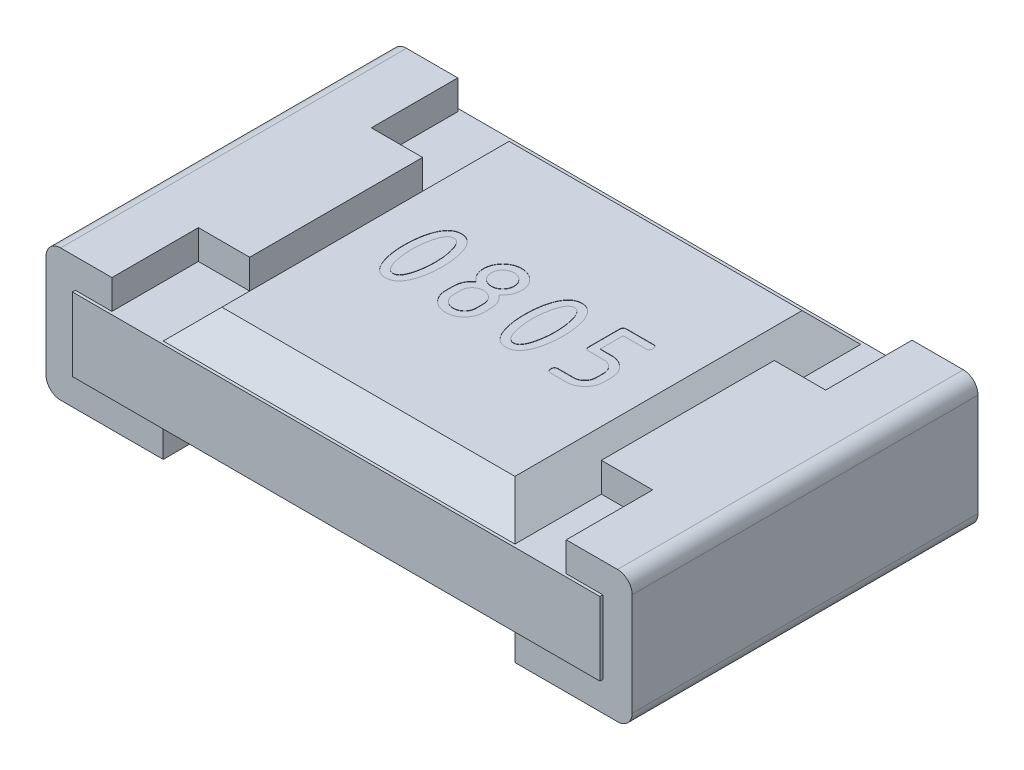
from build123d import *

# Parameters (mm, degrees)
SKETCH1_W           = 1.8
SKETCH1_H           = 1.2
BOSS_EXTRUDE1_DEPTH = 0.125
SKETCH2_W           = 0.4
SKETCH2_H           = 1.18
BOSS_EXTRUDE2_DEPTH = 0.225
FILLET1_R           = 0.05
SKETCH6_W           = 1.55
SKETCH6_H           = 0.295
CUT_EXTRUDE2_DEPTH  = 0.1
SKETCH4_W           = 1.2
SKETCH4_H           = 1.18
BOSS_EXTRUDE3_DEPTH = 0.1
BOSS_EXTRUDE3_TAPER = 45
CUT_EXTRUDE1_DEPTH  = 0.001


with BuildPart() as part:
    # Sketch1 → Boss-Extrude1 (new, symmetric)
    with BuildSketch(Plane(origin=(0, 0, 0), x_dir=(1, 0, 0), z_dir=(0, 1, 0))):
        Rectangle(SKETCH1_W, SKETCH1_H)
    extrude(amount=BOSS_EXTRUDE1_DEPTH, both=True)

    # Sketch2 → Boss-Extrude2 (add, symmetric)
    with BuildSketch(Plane(origin=(0, 0, 0), x_dir=(1, 0, 0), z_dir=(0, 1, 0))):
        with Locations((-0.8, 0)):
            Rectangle(SKETCH2_W, SKETCH2_H)
        with Locations((0.8, 0)):
            Rectangle(SKETCH2_W, SKETCH2_H)
    extrude(amount=BOSS_EXTRUDE2_DEPTH, both=True)

    # Fillet1
    fillet1_edges = [part.edges().sort_by_distance(p)[0] for p in [
        (-1, -0.225, 0),
        (-1, 0.225, 0),
        (1, -0.225, 0),
        (1, 0.225, 0),
    ]]
    fillet(fillet1_edges, radius=FILLET1_R)

    # Sketch6 → Cut-Extrude2 (cut)
    with BuildSketch(Plane(origin=(0, 0.225, 0), x_dir=(1, 0, 0), z_dir=(0, 1, 0))):
        with Locations((0, 0.4425)):
            Rectangle(SKETCH6_W, SKETCH6_H)
        with Locations((0, -0.4425)):
            Rectangle(SKETCH6_W, SKETCH6_H)
    extrude(amount=-CUT_EXTRUDE2_DEPTH, mode=Mode.SUBTRACT)

    # Sketch4 → Boss-Extrude3 (add)
    with BuildSketch(Plane(origin=(0, 0.125, 0), x_dir=(1, 0, 0), z_dir=(0, 1, 0))):
        Rectangle(SKETCH4_W, SKETCH4_H)
    extrude(amount=BOSS_EXTRUDE3_DEPTH, taper=BOSS_EXTRUDE3_TAPER)

    # Sketch5 → Cut-Extrude1 (cut)
    # profile 1 of 4: a face of its own
    with BuildSketch(Plane(origin=(0, 0.225, 0), x_dir=(1, 0, 0), z_dir=(0, 1, 0))):
        with BuildLine():
            add(Edge.make_bspline(
                [(-0.2431, 0.006067785), (-0.243134366, 0.002256348), (-0.24320191, -0.00523479), (-0.243705927, -0.016272331), (-0.244676967, -0.026911155), (-0.245834586, -0.037164348), (-0.247489186, -0.047014055), (-0.249461091, -0.056481238), (-0.251734885, -0.065579409), (-0.253612278, -0.071438245), (-0.254533036, -0.074311679)],
                knots=[0, 0, 0, 0, 1.121884543, 2.204992808, 3.251003932, 4.265943523, 5.241379217, 6.189508073, 7.112053941, 8, 8, 8, 8], degree=3))
            add(Edge.make_bspline(
                [(-0.254533036, -0.074311679), (-0.25593627, -0.078216876), (-0.258619185, -0.085683417), (-0.263819077, -0.095811545), (-0.269537136, -0.104482554), (-0.275985187, -0.111572283), (-0.283068184, -0.117140302), (-0.290837197, -0.121126628), (-0.299271828, -0.123531475), (-0.305124578, -0.123797151), (-0.3081, -0.123932215)],
                knots=[0, 0, 0, 0, 1.267950427, 2.424258098, 3.472816797, 4.435939713, 5.342465326, 6.213003319, 7.091526505, 8, 8, 8, 8], degree=3))
            add(Edge.make_bspline(
                [(-0.3081, -0.123932215), (-0.311075194, -0.123796863), (-0.316927496, -0.123530621), (-0.325365393, -0.121129902), (-0.333111459, -0.117133378), (-0.340235869, -0.111637437), (-0.346641916, -0.104543318), (-0.352384312, -0.095933255), (-0.357592635, -0.08584357), (-0.360265791, -0.07839176), (-0.361666964, -0.074485787)],
                knots=[0, 0, 0, 0, 0.910041478, 1.790080955, 2.662121456, 3.566587881, 4.531373102, 5.576831042, 6.729861149, 8, 8, 8, 8], degree=3))
            add(Edge.make_bspline(
                [(-0.361666964, -0.074485787), (-0.362587784, -0.071612362), (-0.364465304, -0.065753547), (-0.366738106, -0.056655216), (-0.368717853, -0.047169982), (-0.370358986, -0.03729872), (-0.371527901, -0.027008391), (-0.372490729, -0.016349391), (-0.372999665, -0.005273558), (-0.373066109, 0.002236977), (-0.3731, 0.006067785)],
                knots=[0, 0, 0, 0, 0.886064917, 1.806656342, 2.752776557, 3.731751904, 4.744541313, 5.793997073, 6.874810739, 8, 8, 8, 8], degree=3))
            add(Edge.make_bspline(
                [(-0.3731, 0.006067785), (-0.373066109, 0.009898593), (-0.372999665, 0.017409127), (-0.372490729, 0.028484961), (-0.371527901, 0.039143961), (-0.370358986, 0.04943429), (-0.368717853, 0.059305552), (-0.366738106, 0.068790786), (-0.364465304, 0.077889117), (-0.362587784, 0.083747932), (-0.361666964, 0.086621356)],
                knots=[0, 0, 0, 0, 1.125189261, 2.206002927, 3.255458687, 4.268248096, 5.247223443, 6.193343658, 7.113935083, 8, 8, 8, 8], degree=3))
            add(Edge.make_bspline(
                [(-0.361666964, 0.086621356), (-0.360265791, 0.09052733), (-0.357592635, 0.09797914), (-0.352384312, 0.108068825), (-0.346641916, 0.116678887), (-0.340235869, 0.123773007), (-0.333111459, 0.129268948), (-0.325365393, 0.133265472), (-0.316927496, 0.135666191), (-0.311075194, 0.135932433), (-0.3081, 0.136067785)],
                knots=[0, 0, 0, 0, 1.270138851, 2.423168958, 3.468626898, 4.433412119, 5.337878544, 6.209919045, 7.089958522, 8, 8, 8, 8], degree=3))
            add(Edge.make_bspline(
                [(-0.3081, 0.136067785), (-0.305124578, 0.135932721), (-0.299271828, 0.135667045), (-0.290837197, 0.133262198), (-0.283068184, 0.129275872), (-0.275985187, 0.123707853), (-0.269537136, 0.116618124), (-0.263819077, 0.107947115), (-0.258619185, 0.097818987), (-0.25593627, 0.090352446), (-0.254533036, 0.086447249)],
                knots=[0, 0, 0, 0, 0.908473495, 1.786996681, 2.657534674, 3.564060287, 4.527183203, 5.575741902, 6.732049573, 8, 8, 8, 8], degree=3))
            add(Edge.make_bspline(
                [(-0.254533036, 0.086447249), (-0.253612278, 0.083573815), (-0.251734885, 0.077714979), (-0.249461091, 0.068616808), (-0.247489186, 0.059149625), (-0.245834586, 0.049299917), (-0.244676967, 0.039046725), (-0.243705927, 0.0284079), (-0.24320191, 0.01737036), (-0.243134366, 0.009879222), (-0.2431, 0.006067785)],
                knots=[0, 0, 0, 0, 0.887946059, 1.810491927, 2.758620783, 3.734056477, 4.748996068, 5.795007192, 6.878115457, 8, 8, 8, 8], degree=3))
        make_face()
        with BuildLine():
            add(Edge.make_bspline(
                [(-0.2691, 0.006067785), (-0.269164565, 0.011371774), (-0.269292258, 0.021861697), (-0.270712498, 0.037336367), (-0.272766495, 0.052375139), (-0.274933736, 0.062123185), (-0.27600625, 0.066947249)],
                knots=[0, 0, 0, 0, 1.036187695, 2.04931225, 3.03465332, 4, 4, 4, 4], degree=3))
            add(Edge.make_bspline(
                [(-0.27600625, 0.066947249), (-0.276882506, 0.070328868), (-0.278537274, 0.076714897), (-0.281670154, 0.085514047), (-0.285090165, 0.093008527), (-0.288945851, 0.099144454), (-0.293100358, 0.104052317), (-0.297760839, 0.107515979), (-0.302822314, 0.10964842), (-0.306339631, 0.109927906), (-0.3081, 0.110067785)],
                knots=[0, 0, 0, 0, 1.452784662, 2.743516012, 3.881318599, 4.872714509, 5.751019032, 6.539832634, 7.269206463, 8, 8, 8, 8], degree=3))
            add(Edge.make_bspline(
                [(-0.3081, 0.110067785), (-0.309863297, 0.109935467), (-0.313375934, 0.10967188), (-0.318369442, 0.10743954), (-0.322988428, 0.103996272), (-0.327093214, 0.099056903), (-0.330919978, 0.092903131), (-0.334370439, 0.085384287), (-0.337484889, 0.076538566), (-0.339142239, 0.070115494), (-0.340019643, 0.066715106)],
                knots=[0, 0, 0, 0, 0.73024413, 1.454707756, 2.2364598, 3.108818404, 4.106268943, 5.243216136, 6.540552912, 8, 8, 8, 8], degree=3))
            add(Edge.make_bspline(
                [(-0.340019643, 0.066715106), (-0.341107553, 0.061813218), (-0.343288879, 0.05198464), (-0.345441484, 0.036934862), (-0.346827562, 0.021608884), (-0.347008722, 0.011274716), (-0.3471, 0.006067785)],
                knots=[0, 0, 0, 0, 0.984359877, 1.973700231, 2.979037069, 4, 4, 4, 4], degree=3))
            add(Edge.make_bspline(
                [(-0.3471, 0.006067785), (-0.347035475, 0.000783139), (-0.346907864, -0.009668162), (-0.34548544, -0.025104115), (-0.343421597, -0.040159639), (-0.341265077, -0.049948647), (-0.34019375, -0.054811679)],
                knots=[0, 0, 0, 0, 1.032445105, 2.041839016, 3.027215061, 4, 4, 4, 4], degree=3))
            add(Edge.make_bspline(
                [(-0.34019375, -0.054811679), (-0.339317494, -0.058193298), (-0.337662726, -0.064579327), (-0.334529846, -0.073378478), (-0.331109835, -0.080872957), (-0.327254149, -0.087008885), (-0.323099642, -0.091916747), (-0.318439161, -0.095380409), (-0.313377686, -0.09751285), (-0.309860369, -0.097792336), (-0.3081, -0.097932215)],
                knots=[0, 0, 0, 0, 1.452784662, 2.743516012, 3.881318599, 4.872714509, 5.751019032, 6.539832634, 7.269206463, 8, 8, 8, 8], degree=3))
            add(Edge.make_bspline(
                [(-0.3081, -0.097932215), (-0.306339631, -0.097792336), (-0.302822314, -0.09751285), (-0.297760839, -0.095380409), (-0.293100358, -0.091916747), (-0.288945851, -0.087008885), (-0.285090165, -0.080872957), (-0.281670154, -0.073378478), (-0.278537274, -0.064579327), (-0.276882506, -0.058193298), (-0.27600625, -0.054811679)],
                knots=[0, 0, 0, 0, 0.730793537, 1.460167366, 2.248980968, 3.127285491, 4.118681401, 5.256483988, 6.547215338, 8, 8, 8, 8], degree=3))
            add(Edge.make_bspline(
                [(-0.27600625, -0.054811679), (-0.274934923, -0.049948647), (-0.272778403, -0.040159639), (-0.27071456, -0.025104115), (-0.269292136, -0.009668162), (-0.269164525, 0.000783139), (-0.2691, 0.006067785)],
                knots=[0, 0, 0, 0, 0.972784939, 1.958160984, 2.967554895, 4, 4, 4, 4], degree=3))
        make_face(mode=Mode.SUBTRACT)
    # profile 2 of 4: a face of its own
    with BuildSketch(Plane(origin=(0, 0.225, 0), x_dir=(1, 0, 0), z_dir=(0, 1, 0))):
        with BuildLine():
            add(Edge.make_bspline(
                [(-0.1027, -0.123932215), (-0.104907872, -0.123876259), (-0.109263799, -0.123765864), (-0.115669213, -0.122897593), (-0.121821128, -0.121353904), (-0.127739828, -0.119281028), (-0.13340418, -0.116600617), (-0.138778994, -0.113291115), (-0.143976144, -0.109482893), (-0.14877754, -0.105009755), (-0.153250678, -0.100208359), (-0.157058899, -0.095011209), (-0.160368402, -0.089636395), (-0.163048813, -0.083972043), (-0.165121689, -0.078053343), (-0.166665378, -0.071901428), (-0.167533649, -0.065496014), (-0.167644044, -0.061140088), (-0.1677, -0.058932215)],
                knots=[0, 0, 0, 0, 1.035857351, 2.043650141, 3.025599911, 4.00750772, 4.982044535, 5.959747152, 6.965575591, 8, 9.034424409, 10.040252848, 11.017955465, 11.99249228, 12.974400089, 13.956349859, 14.964142649, 16, 16, 16, 16], degree=3))
            Line((-0.1677, -0.058932215), (-0.1677, -0.032932215))
            add(Edge.make_bspline(
                [(-0.1677, -0.032932215), (-0.167624924, -0.030296622), (-0.167477796, -0.02513153), (-0.166234817, -0.017588942), (-0.164170805, -0.010459056), (-0.161429705, -0.003665696), (-0.157677592, 0.002630112), (-0.153262967, 0.008615198), (-0.147949142, 0.014142786), (-0.14392259, 0.017407091), (-0.141874107, 0.019067785)],
                knots=[0, 0, 0, 0, 1.048185513, 2.054176508, 3.031096563, 3.99737623, 4.959754699, 5.938825261, 6.951390663, 8, 8, 8, 8], degree=3))
            add(Edge.make_bspline(
                [(-0.141874107, 0.019067785), (-0.143922854, 0.020728333), (-0.147949927, 0.023992352), (-0.153259992, 0.029522005), (-0.15769825, 0.035513064), (-0.161397629, 0.041836796), (-0.164186674, 0.048606878), (-0.166231796, 0.05572588), (-0.167478597, 0.063266737), (-0.167625195, 0.068432069), (-0.1677, 0.071067785)],
                knots=[0, 0, 0, 0, 1.048668505, 2.061291041, 3.040416849, 4.009506313, 4.968732406, 5.945707584, 6.951755342, 8, 8, 8, 8], degree=3))
            add(Edge.make_bspline(
                [(-0.1677, 0.071067785), (-0.167643965, 0.073275616), (-0.167533413, 0.077631462), (-0.166666283, 0.084037468), (-0.165118391, 0.090187202), (-0.163066834, 0.096097458), (-0.160331876, 0.101732178), (-0.157098693, 0.107134698), (-0.15322603, 0.11228688), (-0.148784079, 0.117093737), (-0.143955941, 0.121553274), (-0.138798745, 0.125433659), (-0.133401581, 0.128732753), (-0.127740529, 0.131417524), (-0.12182094, 0.133489225), (-0.115669265, 0.135033231), (-0.109263786, 0.135901416), (-0.104907868, 0.136011823), (-0.1027, 0.136067785)],
                knots=[0, 0, 0, 0, 1.036004481, 2.043940414, 3.026029657, 4.008076933, 4.974556657, 5.960164742, 6.958858073, 7.993429408, 9.028000743, 10.039406346, 11.017247833, 11.991923067, 12.973970343, 13.956059586, 14.963995519, 16, 16, 16, 16], degree=3))
            add(Edge.make_bspline(
                [(-0.1027, 0.136067785), (-0.100492173, 0.136011744), (-0.096136337, 0.13590118), (-0.089730265, 0.135034136), (-0.083580773, 0.133485928), (-0.077669621, 0.13143554), (-0.072038214, 0.128696254), (-0.066613033, 0.125473585), (-0.061501273, 0.121528694), (-0.056667478, 0.117100307), (-0.052239091, 0.112266512), (-0.0482942, 0.107154752), (-0.045071531, 0.10172957), (-0.042332245, 0.096098164), (-0.040281857, 0.090187012), (-0.038733649, 0.08403752), (-0.037866605, 0.077631448), (-0.037756041, 0.073275612), (-0.0377, 0.071067785)],
                knots=[0, 0, 0, 0, 1.03614655, 2.044220704, 3.026444622, 4.008626568, 4.975238828, 5.960982072, 6.965286792, 8, 9.034713208, 10.039017928, 11.024761172, 11.991373432, 12.973555378, 13.955779296, 14.96385345, 16, 16, 16, 16], degree=3))
            add(Edge.make_bspline(
                [(-0.0377, 0.071067785), (-0.03776729, 0.068430633), (-0.037899243, 0.063259304), (-0.039253347, 0.055735627), (-0.041240314, 0.048579118), (-0.044193301, 0.041836616), (-0.047985694, 0.035487567), (-0.052617132, 0.029540173), (-0.058035445, 0.023970034), (-0.062170313, 0.020724167), (-0.064280357, 0.019067785)],
                knots=[0, 0, 0, 0, 1.040763239, 2.040887161, 3.010889577, 3.969260993, 4.939173083, 5.925181052, 6.941209693, 8, 8, 8, 8], degree=3))
            add(Edge.make_bspline(
                [(-0.064280357, 0.019067785), (-0.062733198, 0.017872105), (-0.059701755, 0.015529338), (-0.055549305, 0.011680079), (-0.051899379, 0.007590032), (-0.048604636, 0.003357022), (-0.045818004, -0.001152152), (-0.043435905, -0.005844166), (-0.041487317, -0.010736194), (-0.040587889, -0.01411816), (-0.0401375, -0.015811679)],
                knots=[0, 0, 0, 0, 1.082926845, 2.121843868, 3.131151544, 4.117203343, 5.089648923, 6.062625877, 7.029860409, 8, 8, 8, 8], degree=3))
            add(Edge.make_bspline(
                [(-0.0401375, -0.015811679), (-0.039928657, -0.016795781), (-0.039464621, -0.018982402), (-0.039074323, -0.022658587), (-0.03856653, -0.027003151), (-0.0382451, -0.032058256), (-0.038031219, -0.037786582), (-0.037855765, -0.044209694), (-0.037742713, -0.05132916), (-0.037714672, -0.056320564), (-0.0377, -0.058932215)],
                knots=[0, 0, 0, 0, 0.557891606, 1.239604717, 2.04926997, 2.985402085, 4.048998662, 5.230248263, 6.550783673, 8, 8, 8, 8], degree=3))
            add(Edge.make_bspline(
                [(-0.0377, -0.058932215), (-0.037755962, -0.061140083), (-0.037866369, -0.065496001), (-0.038734554, -0.07190148), (-0.04027856, -0.078053155), (-0.042350261, -0.083972744), (-0.045035032, -0.089633796), (-0.048334126, -0.09503096), (-0.052214511, -0.100188156), (-0.056674047, -0.105016294), (-0.061480905, -0.109458245), (-0.066633087, -0.113330908), (-0.072035606, -0.116564091), (-0.077670326, -0.119299049), (-0.083580583, -0.121350606), (-0.089730317, -0.122898498), (-0.096136323, -0.123765628), (-0.100492169, -0.12387618), (-0.1027, -0.123932215)],
                knots=[0, 0, 0, 0, 1.036004481, 2.043940414, 3.026029657, 4.008076933, 4.982752167, 5.960593654, 6.971999257, 8.006570592, 9.041141927, 10.039835258, 11.025443343, 11.991923067, 12.973970343, 13.956059586, 14.963995519, 16, 16, 16, 16], degree=3))
        make_face()
        with BuildLine():
            add(Edge.make_bspline(
                [(-0.1027, -0.097932215), (-0.100052154, -0.097814536), (-0.094894664, -0.09758532), (-0.087515388, -0.095308432), (-0.080781739, -0.091719562), (-0.074849178, -0.086783037), (-0.069912654, -0.080850476), (-0.066323784, -0.074116827), (-0.064046895, -0.066737551), (-0.063817679, -0.061580061), (-0.0637, -0.058932215)],
                knots=[0, 0, 0, 0, 1.032801548, 2.011697431, 2.989774545, 4, 5.010225455, 5.988302569, 6.967198452, 8, 8, 8, 8], degree=3))
            Line((-0.0637, -0.058932215), (-0.0637, -0.032932215))
            add(Edge.make_bspline(
                [(-0.0637, -0.032932215), (-0.063823265, -0.030324724), (-0.064065092, -0.02520924), (-0.066296079, -0.017857389), (-0.07001416, -0.011172139), (-0.074957082, -0.005189297), (-0.080939924, -0.000246375), (-0.087625174, 0.003471706), (-0.094977025, 0.005702693), (-0.100092509, 0.00594452), (-0.1027, 0.006067785)],
                knots=[0, 0, 0, 0, 1.01963496, 2.000361676, 2.977215234, 4, 5.022784766, 5.999638324, 6.98036504, 8, 8, 8, 8], degree=3))
            add(Edge.make_bspline(
                [(-0.1027, 0.006067785), (-0.105347846, 0.005950106), (-0.110505336, 0.00572089), (-0.117884612, 0.003444001), (-0.124618261, -0.000144869), (-0.130550822, -0.005081394), (-0.135487346, -0.011013954), (-0.139076216, -0.017747603), (-0.141353105, -0.025126879), (-0.141582321, -0.030284369), (-0.1417, -0.032932215)],
                knots=[0, 0, 0, 0, 1.032801548, 2.011697431, 2.989774545, 4, 5.010225455, 5.988302569, 6.967198452, 8, 8, 8, 8], degree=3))
            Line((-0.1417, -0.032932215), (-0.1417, -0.058932215))
            add(Edge.make_bspline(
                [(-0.1417, -0.058932215), (-0.141582321, -0.061580061), (-0.141353105, -0.066737551), (-0.139076216, -0.074116827), (-0.135487346, -0.080850476), (-0.130550822, -0.086783037), (-0.124618261, -0.091719562), (-0.117884612, -0.095308432), (-0.110505336, -0.09758532), (-0.105347846, -0.097814536), (-0.1027, -0.097932215)],
                knots=[0, 0, 0, 0, 1.032801548, 2.011697431, 2.989774545, 4, 5.010225455, 5.988302569, 6.967198452, 8, 8, 8, 8], degree=3))
        make_face(mode=Mode.SUBTRACT)
        with BuildLine():
            add(Edge.make_bspline(
                [(-0.1027, 0.032067785), (-0.100052154, 0.032185464), (-0.094894664, 0.03241468), (-0.087515388, 0.034691568), (-0.080781739, 0.038280438), (-0.074849178, 0.043216963), (-0.069912654, 0.049149524), (-0.066323784, 0.055883173), (-0.064046895, 0.063262449), (-0.063817679, 0.068419939), (-0.0637, 0.071067785)],
                knots=[0, 0, 0, 0, 1.032801548, 2.011697431, 2.989774545, 4, 5.010225455, 5.988302569, 6.967198452, 8, 8, 8, 8], degree=3))
            add(Edge.make_bspline(
                [(-0.0637, 0.071067785), (-0.063823265, 0.073675276), (-0.064065092, 0.07879076), (-0.066296079, 0.086142611), (-0.07001416, 0.092827861), (-0.074957082, 0.098810703), (-0.080939924, 0.103753625), (-0.087625174, 0.107471706), (-0.094977025, 0.109702693), (-0.100092509, 0.10994452), (-0.1027, 0.110067785)],
                knots=[0, 0, 0, 0, 1.01963496, 2.000361676, 2.977215234, 4, 5.022784766, 5.999638324, 6.98036504, 8, 8, 8, 8], degree=3))
            add(Edge.make_bspline(
                [(-0.1027, 0.110067785), (-0.105347846, 0.109950106), (-0.110505336, 0.10972089), (-0.117884612, 0.107444001), (-0.124618261, 0.103855131), (-0.130550822, 0.098918606), (-0.135487346, 0.092986046), (-0.139076216, 0.086252397), (-0.141353105, 0.078873121), (-0.141582321, 0.073715631), (-0.1417, 0.071067785)],
                knots=[0, 0, 0, 0, 1.032801548, 2.011697431, 2.989774545, 4, 5.010225455, 5.988302569, 6.967198452, 8, 8, 8, 8], degree=3))
            add(Edge.make_bspline(
                [(-0.1417, 0.071067785), (-0.141582321, 0.068419939), (-0.141353105, 0.063262449), (-0.139076216, 0.055883173), (-0.135487346, 0.049149524), (-0.130550822, 0.043216963), (-0.124618261, 0.038280438), (-0.117884612, 0.034691568), (-0.110505336, 0.03241468), (-0.105347846, 0.032185464), (-0.1027, 0.032067785)],
                knots=[0, 0, 0, 0, 1.032801548, 2.011697431, 2.989774545, 4, 5.010225455, 5.988302569, 6.967198452, 8, 8, 8, 8], degree=3))
        make_face(mode=Mode.SUBTRACT)
    # profile 3 of 4: a face of its own
    with BuildSketch(Plane(origin=(0, 0.225, 0), x_dir=(1, 0, 0), z_dir=(0, 1, 0))):
        with BuildLine():
            add(Edge.make_bspline(
                [(0.1677, 0.006067785), (0.167665634, 0.002256348), (0.16759809, -0.00523479), (0.167094073, -0.016272331), (0.166123033, -0.026911155), (0.164965414, -0.037164348), (0.163310814, -0.047014055), (0.161338909, -0.056481238), (0.159065115, -0.065579409), (0.157187722, -0.071438245), (0.156266964, -0.074311679)],
                knots=[0, 0, 0, 0, 1.121884543, 2.204992808, 3.251003932, 4.265943523, 5.241379217, 6.189508073, 7.112053941, 8, 8, 8, 8], degree=3))
            add(Edge.make_bspline(
                [(0.156266964, -0.074311679), (0.15486373, -0.078216876), (0.152180815, -0.085683417), (0.146980923, -0.095811545), (0.141262864, -0.104482554), (0.134814813, -0.111572283), (0.127731816, -0.117140302), (0.119962803, -0.121126628), (0.111528172, -0.123531475), (0.105675422, -0.123797151), (0.1027, -0.123932215)],
                knots=[0, 0, 0, 0, 1.267950427, 2.424258098, 3.472816797, 4.435939713, 5.342465326, 6.213003319, 7.091526505, 8, 8, 8, 8], degree=3))
            add(Edge.make_bspline(
                [(0.1027, -0.123932215), (0.099724806, -0.123796863), (0.093872504, -0.123530621), (0.085434607, -0.121129902), (0.077688541, -0.117133378), (0.070564131, -0.111637437), (0.064158084, -0.104543318), (0.058415688, -0.095933255), (0.053207365, -0.08584357), (0.050534209, -0.07839176), (0.049133036, -0.074485787)],
                knots=[0, 0, 0, 0, 0.910041478, 1.790080955, 2.662121456, 3.566587881, 4.531373102, 5.576831042, 6.729861149, 8, 8, 8, 8], degree=3))
            add(Edge.make_bspline(
                [(0.049133036, -0.074485787), (0.048212216, -0.071612362), (0.046334696, -0.065753547), (0.044061894, -0.056655216), (0.042082147, -0.047169982), (0.040441014, -0.03729872), (0.039272099, -0.027008391), (0.038309271, -0.016349391), (0.037800335, -0.005273558), (0.037733891, 0.002236977), (0.0377, 0.006067785)],
                knots=[0, 0, 0, 0, 0.886064917, 1.806656342, 2.752776557, 3.731751904, 4.744541313, 5.793997073, 6.874810739, 8, 8, 8, 8], degree=3))
            add(Edge.make_bspline(
                [(0.0377, 0.006067785), (0.037733891, 0.009898593), (0.037800335, 0.017409127), (0.038309271, 0.028484961), (0.039272099, 0.039143961), (0.040441014, 0.04943429), (0.042082147, 0.059305552), (0.044061894, 0.068790786), (0.046334696, 0.077889117), (0.048212216, 0.083747932), (0.049133036, 0.086621356)],
                knots=[0, 0, 0, 0, 1.125189261, 2.206002927, 3.255458687, 4.268248096, 5.247223443, 6.193343658, 7.113935083, 8, 8, 8, 8], degree=3))
            add(Edge.make_bspline(
                [(0.049133036, 0.086621356), (0.050534209, 0.09052733), (0.053207365, 0.09797914), (0.058415688, 0.108068825), (0.064158084, 0.116678887), (0.070564131, 0.123773007), (0.077688541, 0.129268948), (0.085434607, 0.133265472), (0.093872504, 0.135666191), (0.099724806, 0.135932433), (0.1027, 0.136067785)],
                knots=[0, 0, 0, 0, 1.270138851, 2.423168958, 3.468626898, 4.433412119, 5.337878544, 6.209919045, 7.089958522, 8, 8, 8, 8], degree=3))
            add(Edge.make_bspline(
                [(0.1027, 0.136067785), (0.105675422, 0.135932721), (0.111528172, 0.135667045), (0.119962803, 0.133262198), (0.127731816, 0.129275872), (0.134814813, 0.123707853), (0.141262864, 0.116618124), (0.146980923, 0.107947115), (0.152180815, 0.097818987), (0.15486373, 0.090352446), (0.156266964, 0.086447249)],
                knots=[0, 0, 0, 0, 0.908473495, 1.786996681, 2.657534674, 3.564060287, 4.527183203, 5.575741902, 6.732049573, 8, 8, 8, 8], degree=3))
            add(Edge.make_bspline(
                [(0.156266964, 0.086447249), (0.157187722, 0.083573815), (0.159065115, 0.077714979), (0.161338909, 0.068616808), (0.163310814, 0.059149625), (0.164965414, 0.049299917), (0.166123033, 0.039046725), (0.167094073, 0.0284079), (0.16759809, 0.01737036), (0.167665634, 0.009879222), (0.1677, 0.006067785)],
                knots=[0, 0, 0, 0, 0.887946059, 1.810491927, 2.758620783, 3.734056477, 4.748996068, 5.795007192, 6.878115457, 8, 8, 8, 8], degree=3))
        make_face()
        with BuildLine():
            add(Edge.make_bspline(
                [(0.1417, 0.006067785), (0.141635435, 0.011371774), (0.141507742, 0.021861697), (0.140087502, 0.037336367), (0.138033505, 0.052375139), (0.135866264, 0.062123185), (0.13479375, 0.066947249)],
                knots=[0, 0, 0, 0, 1.036187695, 2.04931225, 3.03465332, 4, 4, 4, 4], degree=3))
            add(Edge.make_bspline(
                [(0.13479375, 0.066947249), (0.133917494, 0.070328868), (0.132262726, 0.076714897), (0.129129846, 0.085514047), (0.125709835, 0.093008527), (0.121854149, 0.099144454), (0.117699642, 0.104052317), (0.113039161, 0.107515979), (0.107977686, 0.10964842), (0.104460369, 0.109927906), (0.1027, 0.110067785)],
                knots=[0, 0, 0, 0, 1.452784662, 2.743516012, 3.881318599, 4.872714509, 5.751019032, 6.539832634, 7.269206463, 8, 8, 8, 8], degree=3))
            add(Edge.make_bspline(
                [(0.1027, 0.110067785), (0.100936703, 0.109935467), (0.097424066, 0.10967188), (0.092430558, 0.10743954), (0.087811572, 0.103996272), (0.083706786, 0.099056903), (0.079880022, 0.092903131), (0.076429561, 0.085384287), (0.073315111, 0.076538566), (0.071657761, 0.070115494), (0.070780357, 0.066715106)],
                knots=[0, 0, 0, 0, 0.73024413, 1.454707756, 2.2364598, 3.108818404, 4.106268943, 5.243216136, 6.540552912, 8, 8, 8, 8], degree=3))
            add(Edge.make_bspline(
                [(0.070780357, 0.066715106), (0.069692447, 0.061813218), (0.067511121, 0.05198464), (0.065358516, 0.036934862), (0.063972438, 0.021608884), (0.063791278, 0.011274716), (0.0637, 0.006067785)],
                knots=[0, 0, 0, 0, 0.984359877, 1.973700231, 2.979037069, 4, 4, 4, 4], degree=3))
            add(Edge.make_bspline(
                [(0.0637, 0.006067785), (0.063764525, 0.000783139), (0.063892136, -0.009668162), (0.06531456, -0.025104115), (0.067378403, -0.040159639), (0.069534923, -0.049948647), (0.07060625, -0.054811679)],
                knots=[0, 0, 0, 0, 1.032445105, 2.041839016, 3.027215061, 4, 4, 4, 4], degree=3))
            add(Edge.make_bspline(
                [(0.07060625, -0.054811679), (0.071482506, -0.058193298), (0.073137274, -0.064579327), (0.076270154, -0.073378478), (0.079690165, -0.080872957), (0.083545851, -0.087008885), (0.087700358, -0.091916747), (0.092360839, -0.095380409), (0.097422314, -0.09751285), (0.100939631, -0.097792336), (0.1027, -0.097932215)],
                knots=[0, 0, 0, 0, 1.452784662, 2.743516012, 3.881318599, 4.872714509, 5.751019032, 6.539832634, 7.269206463, 8, 8, 8, 8], degree=3))
            add(Edge.make_bspline(
                [(0.1027, -0.097932215), (0.104460369, -0.097792336), (0.107977686, -0.09751285), (0.113039161, -0.095380409), (0.117699642, -0.091916747), (0.121854149, -0.087008885), (0.125709835, -0.080872957), (0.129129846, -0.073378478), (0.132262726, -0.064579327), (0.133917494, -0.058193298), (0.13479375, -0.054811679)],
                knots=[0, 0, 0, 0, 0.730793537, 1.460167366, 2.248980968, 3.127285491, 4.118681401, 5.256483988, 6.547215338, 8, 8, 8, 8], degree=3))
            add(Edge.make_bspline(
                [(0.13479375, -0.054811679), (0.135865077, -0.049948647), (0.138021597, -0.040159639), (0.14008544, -0.025104115), (0.141507864, -0.009668162), (0.141635475, 0.000783139), (0.1417, 0.006067785)],
                knots=[0, 0, 0, 0, 0.972784939, 1.958160984, 2.967554895, 4, 4, 4, 4], degree=3))
        make_face(mode=Mode.SUBTRACT)
    # profile 4 of 4: a face of its own
    with BuildSketch(Plane(origin=(0, 0.225, 0), x_dir=(1, 0, 0), z_dir=(0, 1, 0))):
        with BuildLine():
            Line((0.2431, 0.019067785), (0.2431, 0.123067785))
            add(Edge.make_bspline(
                [(0.2431, 0.123067785), (0.243148675, 0.124095579), (0.243239565, 0.126014782), (0.24380003, 0.12872717), (0.244843419, 0.131002312), (0.246297123, 0.132905988), (0.248173384, 0.134370131), (0.250494699, 0.135356003), (0.253161856, 0.136012579), (0.25508965, 0.136048801), (0.2561, 0.136067785)],
                knots=[0, 0, 0, 0, 1.171278472, 2.187130384, 3.133692503, 3.997641031, 4.892513739, 5.809895742, 6.852174597, 8, 8, 8, 8], degree=3))
            Line((0.2561, 0.136067785), (0.3471, 0.136067785))
            add(Edge.make_bspline(
                [(0.3471, 0.136067785), (0.347976415, 0.136050849), (0.349640276, 0.136018696), (0.351934378, 0.135335534), (0.35394922, 0.134366739), (0.355523028, 0.132854644), (0.356801735, 0.13098889), (0.357629226, 0.128693838), (0.358166863, 0.12601384), (0.358216327, 0.124096261), (0.358242857, 0.123067785)],
                knots=[0, 0, 0, 0, 1.068261721, 2.028079452, 2.907358655, 3.778947221, 4.665850375, 5.655597643, 6.742602228, 8, 8, 8, 8], degree=3))
            add(Edge.make_bspline(
                [(0.358242857, 0.123067785), (0.358211852, 0.122059899), (0.358152945, 0.120145026), (0.357656175, 0.117469205), (0.356763917, 0.115189886), (0.355566536, 0.113278082), (0.353907966, 0.111849106), (0.351965766, 0.110762577), (0.34962329, 0.110214983), (0.347972752, 0.110118698), (0.3471, 0.110067785)],
                knots=[0, 0, 0, 0, 1.235590019, 2.347486928, 3.316607166, 4.224570492, 5.081519046, 5.97322276, 6.928305512, 8, 8, 8, 8], degree=3))
            Line((0.3471, 0.110067785), (0.2691, 0.110067785))
            Line((0.2691, 0.110067785), (0.2691, 0.032067785))
            Line((0.2691, 0.032067785), (0.3081, 0.032067785))
            add(Edge.make_bspline(
                [(0.3081, 0.032067785), (0.310309153, 0.032020119), (0.314670307, 0.03192602), (0.321055436, 0.030938412), (0.32722695, 0.029505201), (0.333145174, 0.027443195), (0.338746408, 0.024626687), (0.344188971, 0.021419746), (0.349299048, 0.017470111), (0.354129035, 0.013040006), (0.358584801, 0.008206594), (0.362465626, 0.00305058), (0.365766553, -0.002346202), (0.368435821, -0.00799338), (0.370533108, -0.013884477), (0.372063484, -0.020021688), (0.372931433, -0.026407079), (0.373043462, -0.030743674), (0.3731, -0.032932215)],
                knots=[0, 0, 0, 0, 1.036592186, 2.046367411, 3.026869952, 4.009474324, 4.98046233, 5.966629532, 6.971366193, 8.00652442, 9.041682647, 10.053662, 11.032058197, 12.007286346, 12.981329115, 13.963975477, 14.972483193, 16, 16, 16, 16], degree=3))
            Line((0.3731, -0.032932215), (0.3731, -0.058932215))
            add(Edge.make_bspline(
                [(0.3731, -0.058932215), (0.373052414, -0.06114141), (0.372958473, -0.065502648), (0.371969717, -0.071887171), (0.370540725, -0.078060909), (0.368457294, -0.083987342), (0.365695642, -0.089618712), (0.362412031, -0.095032939), (0.358526908, -0.100188493), (0.354065682, -0.105012805), (0.349259019, -0.109482219), (0.344063044, -0.113290866), (0.338688613, -0.116602205), (0.333038141, -0.119267118), (0.327147925, -0.121365571), (0.321010476, -0.122895631), (0.314625149, -0.123763666), (0.310288546, -0.123875683), (0.3081, -0.123932215)],
                knots=[0, 0, 0, 0, 1.03644959, 2.046085907, 3.026453569, 4.008922771, 4.987943079, 5.966204685, 6.978044827, 8.013060656, 9.048076484, 10.054479993, 11.032741599, 12.007835593, 12.981744371, 13.964255558, 14.972624541, 16, 16, 16, 16], degree=3))
            Line((0.3081, -0.123932215), (0.2561, -0.123932215))
            add(Edge.make_bspline(
                [(0.2561, -0.123932215), (0.255092993, -0.123878839), (0.253177052, -0.123777286), (0.250465536, -0.123261543), (0.248212891, -0.122148958), (0.246253435, -0.120778781), (0.244883257, -0.118819324), (0.243770672, -0.116566679), (0.243254929, -0.113855163), (0.243153376, -0.111939222), (0.2431, -0.110932215)],
                knots=[0, 0, 0, 0, 1.150813752, 2.189550435, 3.117366144, 4, 4.882633856, 5.810449565, 6.849186248, 8, 8, 8, 8], degree=3))
            add(Edge.make_bspline(
                [(0.2431, -0.110932215), (0.243113806, -0.109900968), (0.24313966, -0.107969794), (0.243841041, -0.105301521), (0.244758179, -0.102958504), (0.246304886, -0.101136036), (0.248114789, -0.099608472), (0.250441221, -0.098648816), (0.253102479, -0.097986003), (0.255031153, -0.097950711), (0.256041964, -0.097932215)],
                knots=[0, 0, 0, 0, 1.171153265, 2.193170214, 3.131774486, 4.010381834, 4.888989181, 5.807411693, 6.850872717, 8, 8, 8, 8], degree=3))
            Line((0.256041964, -0.097932215), (0.307751786, -0.097932215))
            add(Edge.make_bspline(
                [(0.307751786, -0.097932215), (0.310379803, -0.097812243), (0.315516977, -0.097577724), (0.322864842, -0.095320429), (0.329558113, -0.091718123), (0.335432587, -0.08676431), (0.340361446, -0.080850864), (0.343970192, -0.074126874), (0.346154217, -0.066726611), (0.34639559, -0.061578206), (0.346519643, -0.058932215)],
                knots=[0, 0, 0, 0, 1.028113879, 2.00972855, 2.983840323, 3.991032407, 5.004063664, 5.984857292, 6.964329947, 8, 8, 8, 8], degree=3))
            Line((0.346519643, -0.058932215), (0.346519643, -0.032932215))
            add(Edge.make_bspline(
                [(0.346519643, -0.032932215), (0.346397813, -0.030323918), (0.346158801, -0.025206853), (0.343910083, -0.017875432), (0.340277049, -0.011153374), (0.335318413, -0.005211032), (0.329401178, -0.000247224), (0.322754965, 0.003483675), (0.315434691, 0.005695129), (0.310339481, 0.00594227), (0.307751786, 0.006067785)],
                knots=[0, 0, 0, 0, 1.022656678, 2.006289806, 2.982404609, 4.008220429, 5.028189808, 6.001281017, 6.984914145, 8, 8, 8, 8], degree=3))
            Line((0.307751786, 0.006067785), (0.256041964, 0.006067785))
            add(Edge.make_bspline(
                [(0.256041964, 0.006067785), (0.255034507, 0.006120679), (0.253117708, 0.006221315), (0.25041194, 0.006743206), (0.248154424, 0.007828883), (0.246260987, 0.009263031), (0.244797879, 0.011141691), (0.243811712, 0.013462322), (0.243155226, 0.016129689), (0.243118991, 0.018057452), (0.2431, 0.019067785)],
                knots=[0, 0, 0, 0, 1.152245291, 2.192274096, 3.121243949, 3.987402553, 4.884564444, 5.804293213, 6.849238333, 8, 8, 8, 8], degree=3))
        make_face()
    extrude(amount=-CUT_EXTRUDE1_DEPTH, mode=Mode.SUBTRACT)


solid = part.part
